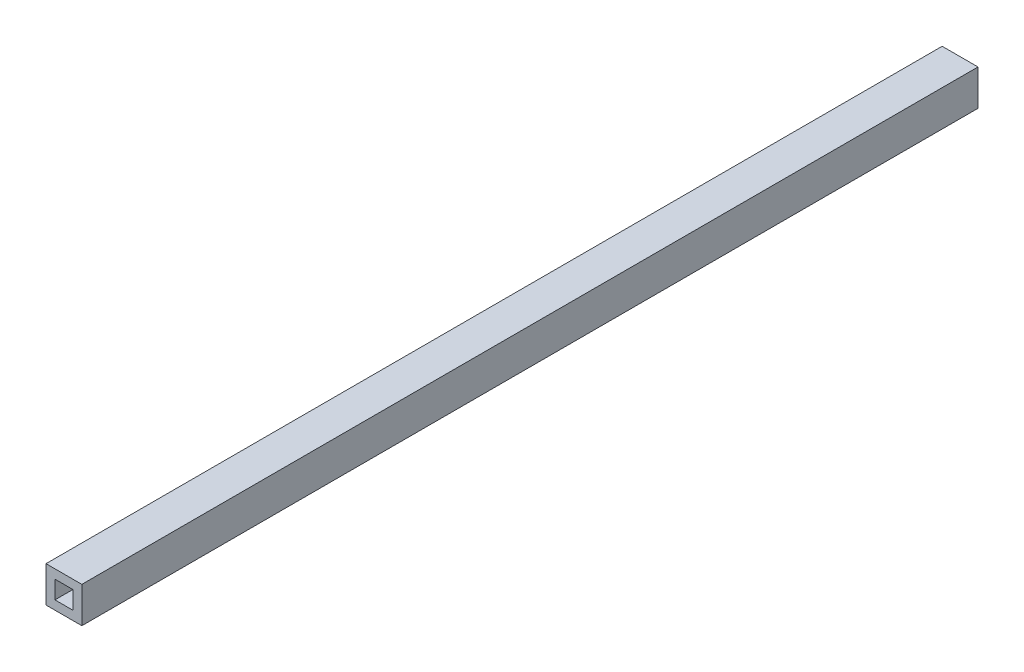
from build123d import *

# Parameters (mm, degrees)
SKETCH1_W           = 20
SKETCH1_H           = 20
SKETCH1_W_2         = 10
SKETCH1_H_2         = 10
EXTRUDE_THIN1_DEPTH = 500


with BuildPart() as part:
    # Sketch1 → Extrude-Thin1 (new body)
    with BuildSketch(Plane.XY):
        Rectangle(SKETCH1_W, SKETCH1_H)
        Rectangle(SKETCH1_W_2, SKETCH1_H_2, mode=Mode.SUBTRACT)
    extrude(amount=EXTRUDE_THIN1_DEPTH)


solid = part.part
